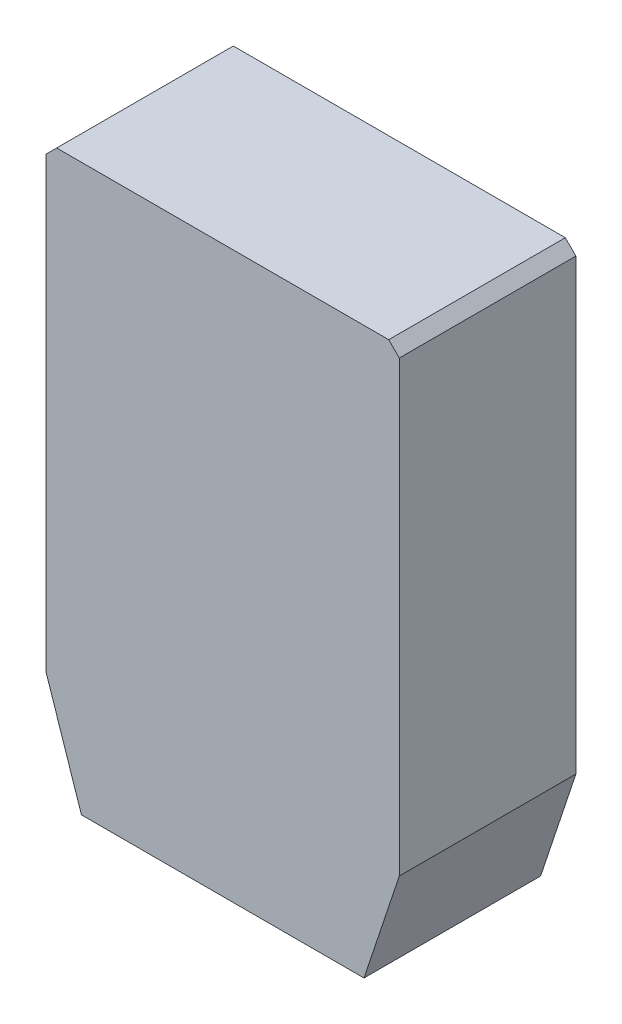
from build123d import *

# Parameters (mm, degrees)
BOSS_EXTRUDE1_DEPTH = 50


with BuildPart() as part:
    # Sketch1 → Boss-Extrude1 (new body)
    with BuildSketch(Plane.XY):
        Polygon((-47, 80), (47, 80), (50, 77), (50, -50), (40, -80), (-40, -80), (-50, -50), (-50, 77), align=None)
    extrude(amount=BOSS_EXTRUDE1_DEPTH)


solid = part.part
